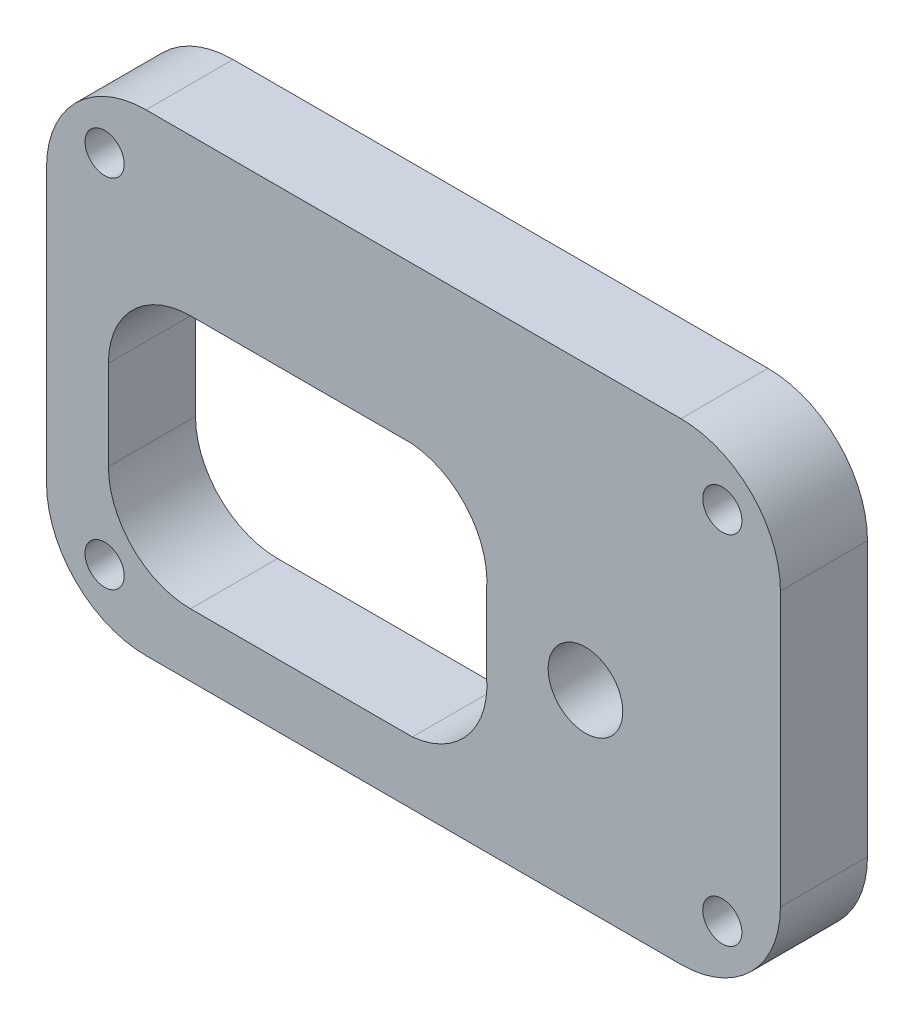
from build123d import *

# Parameters (mm, degrees)
SKETCH1_W           = 37.465
SKETCH1_H           = 24.13
BOSS_EXTRUDE1_DEPTH = 4.445
CUT_EXTRUDE2_DEPTH  = 2.54
FILLET1_R           = 5.08
CUT_EXTRUDE4_DEPTH  = 2.54
SKETCH4_R           = 1.27
CUT_EXTRUDE5_DEPTH  = 2.54
SKETCH5_R           = 1.905
SKETCH5_R_2         = 1.27
CUT_EXTRUDE6_DEPTH  = 0.635
CUT_EXTRUDE7_DEPTH  = 2.54
BOSS_EXTRUDE2_START = 2.54
SKETCH7_R           = 1.905
BOSS_EXTRUDE2_DEPTH = 2.54
SKETCH8_R           = 1
CUT_EXTRUDE8_DEPTH  = 45.784385114


with BuildPart() as part:
    # Sketch1 → Boss-Extrude1 (new body)
    with BuildSketch(Plane.XY):
        with Locations((18.7325, 12.065)):
            Rectangle(SKETCH1_W, SKETCH1_H)
    extrude(amount=BOSS_EXTRUDE1_DEPTH)

    # Sketch2 → Cut-Extrude2 (cut)
    # profile 1 of 4: a face of its own
    with BuildSketch(Plane.XY.offset(4.445)):
        with BuildLine():
            Line((35.59175, 5.7785), (35.59175, 12.065))
            Line((35.59175, 12.065), (35.59175, 18.3515))
            ThreePointArc((35.59175, 18.3515), (34.135361545, 21.710109865), (30.681521372, 22.9235))
            Line((30.681521372, 22.9235), (18.7325, 22.9235))
            Line((18.7325, 22.9235), (6.107021372, 22.9235))
            ThreePointArc((6.107021372, 22.9235), (3.090639267, 21.470453234), (1.87325, 18.3515))
            Line((1.87325, 18.3515), (1.87325, 12.065))
            Line((1.87325, 12.065), (1.87325, 5.7785))
            ThreePointArc((1.87325, 5.7785), (3.212357796, 2.545607796), (6.44525, 1.2065))
            Line((6.44525, 1.2065), (18.7325, 1.2065))
            Line((18.7325, 1.2065), (31.01975, 1.2065))
            ThreePointArc((31.01975, 1.2065), (34.252642204, 2.545607796), (35.59175, 5.7785))
        make_face()
        with BuildLine():
            ThreePointArc((7.493, 3.175), (4.439712919, 4.439712919), (3.175, 7.493))
            Line((3.175, 7.493), (3.175, 16.637))
            ThreePointArc((3.175, 16.637), (4.317872951, 19.576666289), (7.154771372, 20.955))
            Line((7.154771372, 20.955), (7.493, 20.955))
            Line((7.493, 20.955), (29.633771372, 20.955))
            ThreePointArc((29.633771372, 20.955), (32.908147923, 19.81638289), (34.29, 16.637))
            Line((34.29, 16.637), (34.29, 7.493))
            ThreePointArc((34.29, 7.493), (33.025287081, 4.439712919), (29.972, 3.175))
            Line((29.972, 3.175), (7.493, 3.175))
        make_face(mode=Mode.SUBTRACT)
    # profile 2 of 4: a face of its own
    with BuildSketch(Plane.XY.offset(4.445)):
        with BuildLine():
            ThreePointArc((3.175, 16.637), (4.439712919, 19.690287081), (7.493, 20.955))
            Line((7.493, 20.955), (29.972, 20.955))
            ThreePointArc((29.972, 20.955), (33.025287081, 19.690287081), (34.29, 16.637))
            Line((34.29, 16.637), (34.29, 7.493))
            ThreePointArc((34.29, 7.493), (33.025287081, 4.439712919), (29.972, 3.175))
            Line((29.972, 3.175), (7.493, 3.175))
            ThreePointArc((7.493, 3.175), (4.439712919, 4.439712919), (3.175, 7.493))
            Line((3.175, 7.493), (3.175, 16.637))
        make_face()
    # profile 3 of 4: a face of its own
    with BuildSketch(Plane.XY.offset(4.445)):
        with BuildLine():
            ThreePointArc((7.154771372, 20.955), (4.317872951, 19.576666289), (3.175, 16.637))
            ThreePointArc((3.175, 16.637), (4.439712919, 19.690287081), (7.493, 20.955))
            Line((7.493, 20.955), (7.154771372, 20.955))
        make_face()
    # profile 4 of 4: a face of its own
    with BuildSketch(Plane.XY.offset(4.445)):
        with BuildLine():
            ThreePointArc((34.29, 16.637), (32.908147923, 19.81638289), (29.633771372, 20.955))
            Line((29.633771372, 20.955), (29.972, 20.955))
            ThreePointArc((29.972, 20.955), (33.025287081, 19.690287081), (34.29, 16.637))
        make_face()
    extrude(amount=-CUT_EXTRUDE2_DEPTH, mode=Mode.SUBTRACT)

    # Fillet1
    fillet1_edges = [part.edges().sort_by_distance(p)[0] for p in [
        (0, 24.13, 2.2225),
        (37.465, 24.13, 2.2225),
        (37.465, 0, 2.2225),
        (0, 0, 2.2225),
    ]]
    fillet(fillet1_edges, radius=FILLET1_R)

    # Sketch3 → Cut-Extrude4 (cut)
    with BuildSketch(Plane.XY.offset(1.905)):
        with BuildLine():
            Line((7.350869654, 16.158973759), (18.677995313, 16.158973759))
            ThreePointArc((18.677995313, 16.158973759), (21.522821275, 14.644991178), (22.463869654, 11.5628481))
            Line((22.463869654, 11.5628481), (22.463869654, 7.801099417))
            ThreePointArc((22.463869654, 7.801099417), (21.522821275, 4.718956339), (18.677995313, 3.204973759))
            Line((18.677995313, 3.204973759), (7.350869654, 3.204973759))
            ThreePointArc((7.350869654, 3.204973759), (4.387385134, 4.432489239), (3.159869654, 7.395973759))
            Line((3.159869654, 7.395973759), (3.159869654, 11.967973759))
            ThreePointArc((3.159869654, 11.967973759), (4.387385134, 14.931458278), (7.350869654, 16.158973759))
        make_face()
    extrude(amount=-CUT_EXTRUDE4_DEPTH, mode=Mode.SUBTRACT)

    # Sketch4 → Cut-Extrude5 (cut)
    with BuildSketch(Plane.XY.offset(1.905)):
        with Locations((27.511650569, 9.68988988)):
            Circle(SKETCH4_R)
    extrude(amount=-CUT_EXTRUDE5_DEPTH, mode=Mode.SUBTRACT)

    # Sketch5 → Cut-Extrude6 (cut)
    with BuildSketch(Plane.XY.offset(1.905)):
        with Locations((27.511650569, 9.68988988)):
            Circle(SKETCH5_R)
        with Locations((27.511650569, 9.68988988)):
            Circle(SKETCH5_R_2, mode=Mode.SUBTRACT)
    extrude(amount=-CUT_EXTRUDE6_DEPTH, mode=Mode.SUBTRACT)

    # Sketch6 → Cut-Extrude7 (cut)
    with BuildSketch(Plane.XY.offset(4.445)):
        with BuildLine():
            Line((1.542829573, 18.47723), (1.542829573, 5.65277))
            ThreePointArc((1.542829573, 5.65277), (2.908719525, 2.355219952), (6.206269573, 0.98933))
            Line((6.206269573, 0.98933), (31.272259573, 0.98933))
            ThreePointArc((31.272259573, 0.98933), (34.56980962, 2.355219952), (35.935699573, 5.65277))
            Line((35.935699573, 5.65277), (35.935699573, 18.47723))
            ThreePointArc((35.935699573, 18.47723), (34.450183348, 21.903012063), (30.927266372, 23.14067))
            Line((30.927266372, 23.14067), (5.861276372, 23.14067))
            ThreePointArc((5.861276372, 23.14067), (2.784566625, 21.658562299), (1.542829573, 18.47723))
        make_face()
        with BuildLine():
            Line((6.44525, 1.2065), (31.01975, 1.2065))
            ThreePointArc((31.01975, 1.2065), (34.252642204, 2.545607796), (35.59175, 5.7785))
            Line((35.59175, 5.7785), (35.59175, 18.3515))
            ThreePointArc((35.59175, 18.3515), (34.135361545, 21.710109865), (30.681521372, 22.9235))
            Line((30.681521372, 22.9235), (6.107021372, 22.9235))
            ThreePointArc((6.107021372, 22.9235), (3.090639267, 21.470453234), (1.87325, 18.3515))
            Line((1.87325, 18.3515), (1.87325, 5.7785))
            ThreePointArc((1.87325, 5.7785), (3.212357796, 2.545607796), (6.44525, 1.2065))
        make_face(mode=Mode.SUBTRACT)
    extrude(amount=-CUT_EXTRUDE7_DEPTH, mode=Mode.SUBTRACT)

    # Sketch7 → Boss-Extrude2 (add)
    with BuildSketch(Plane.XY.offset(1.905).offset(BOSS_EXTRUDE2_START)):
        with BuildLine():
            Line((1.542829573, 18.47723), (1.542829573, 5.65277))
            ThreePointArc((1.542829573, 5.65277), (2.908719525, 2.355219952), (6.206269573, 0.98933))
            Line((6.206269573, 0.98933), (31.272259573, 0.98933))
            ThreePointArc((31.272259573, 0.98933), (34.56980962, 2.355219952), (35.935699573, 5.65277))
            Line((35.935699573, 5.65277), (35.935699573, 18.47723))
            ThreePointArc((35.935699573, 18.47723), (34.450183348, 21.903012063), (30.927266372, 23.14067))
            Line((30.927266372, 23.14067), (5.861276372, 23.14067))
            ThreePointArc((5.861276372, 23.14067), (2.784566625, 21.658562299), (1.542829573, 18.47723))
        make_face()
        with Locations((27.511650569, 9.68988988)):
            Circle(SKETCH7_R, mode=Mode.SUBTRACT)
        with BuildLine():
            Line((3.159869654, 7.395973759), (3.159869654, 11.967973759))
            ThreePointArc((3.159869654, 11.967973759), (4.387385134, 14.931458278), (7.350869654, 16.158973759))
            Line((7.350869654, 16.158973759), (18.677995313, 16.158973759))
            ThreePointArc((18.677995313, 16.158973759), (21.522821275, 14.644991178), (22.463869654, 11.5628481))
            Line((22.463869654, 11.5628481), (22.463869654, 7.801099417))
            ThreePointArc((22.463869654, 7.801099417), (21.522821275, 4.718956339), (18.677995313, 3.204973759))
            Line((18.677995313, 3.204973759), (7.350869654, 3.204973759))
            ThreePointArc((7.350869654, 3.204973759), (4.387385134, 4.432489239), (3.159869654, 7.395973759))
        make_face(mode=Mode.SUBTRACT)
    extrude(amount=-BOSS_EXTRUDE2_DEPTH)

    # Sketch8 → Cut-Extrude8 (cut, through all)
    with BuildSketch(Plane(origin=(0, 0, 0), x_dir=(-1, 0, 0), z_dir=(0, 0, -1))):
        with Locations((-34.499249276, 21.164249276)):
            Circle(SKETCH8_R)
        with Locations((-34.499249276, 2.965750724)):
            Circle(SKETCH8_R)
        with Locations((-2.965750724, 2.965750724)):
            Circle(SKETCH8_R)
        with Locations((-2.965750724, 21.164249276)):
            Circle(SKETCH8_R)
    extrude(amount=-CUT_EXTRUDE8_DEPTH, mode=Mode.SUBTRACT)


solid = part.part
